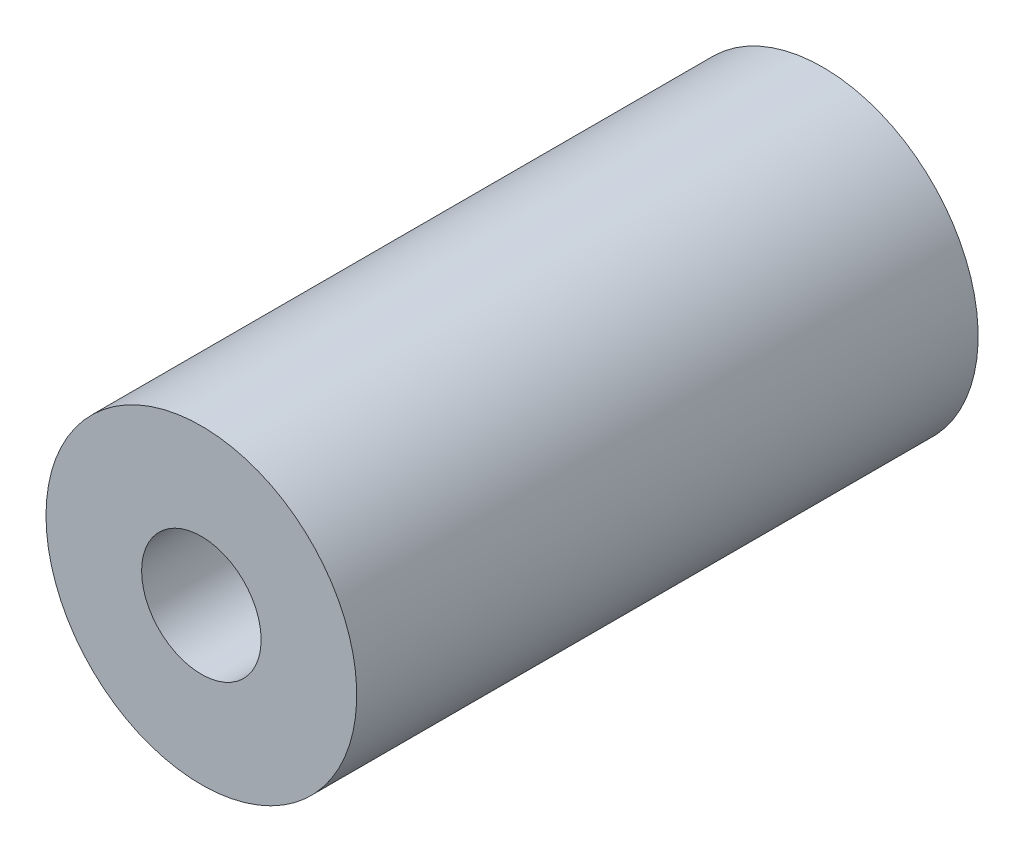
from build123d import *

# Parameters (mm, degrees)
SKETCH_1_R      = 3.25
SKETCH_1_R_2    = 1.25
EXTRUDE_1_DEPTH = 13


with BuildPart() as part:
    # 草图1 → 凸台-拉伸1 (new body)
    with BuildSketch(Plane.XY):
        with Locations(Location((0, 0, 0), (0, 0, 180))):
            Circle(SKETCH_1_R)
        with Locations(Location((0, 0, 0), (0, 0, 180))):
            Circle(SKETCH_1_R_2, mode=Mode.SUBTRACT)
    extrude(amount=EXTRUDE_1_DEPTH)


solid = part.part
